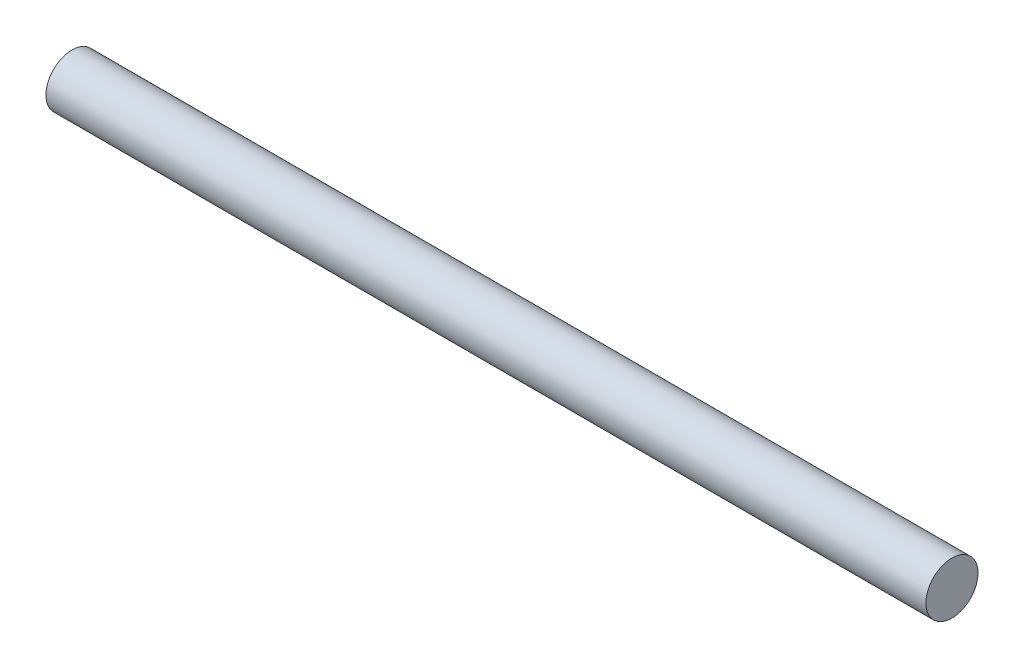
from build123d import *

# Parameters (mm, degrees)
SKETCH1_R           = 2.25
BOSS_EXTRUDE1_DEPTH = 76


with BuildPart() as part:
    # Sketch1 → Boss-Extrude1 (new body)
    with BuildSketch(Plane(origin=(0, 0, 0), x_dir=(0, 0, -1), z_dir=(1, 0, 0))):
        Circle(SKETCH1_R)
    extrude(amount=BOSS_EXTRUDE1_DEPTH)


solid = part.part
